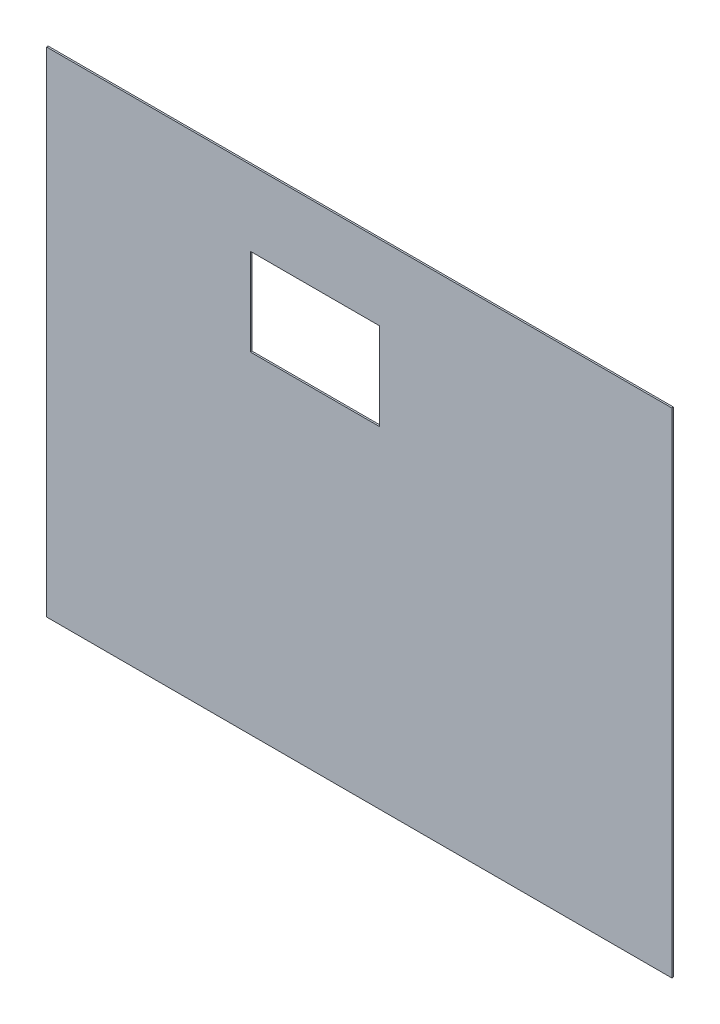
from build123d import *

# Parameters (mm, degrees)
CROQUIS1_W              = 380
CROQUIS1_H              = 300
SALIENTE_EXTRUIR1_DEPTH = 1
CROQUIS2_W              = 78.552049313
CROQUIS2_H              = 53.022633285
CORTAR_EXTRUIR1_DEPTH   = 243.07643421


with BuildPart() as part:
    # Croquis1 → Saliente-Extruir1 (new body)
    with BuildSketch(Plane.XY):
        Rectangle(CROQUIS1_W, CROQUIS1_H)
    extrude(amount=SALIENTE_EXTRUIR1_DEPTH)

    # Croquis2 → Cortar-Extruir1 (cut, through all)
    with BuildSketch(Plane.XY.offset(1)):
        with Locations((-26.838616849, 77.897448901)):
            Rectangle(CROQUIS2_W, CROQUIS2_H)
    extrude(amount=-CORTAR_EXTRUIR1_DEPTH, mode=Mode.SUBTRACT)


solid = part.part
